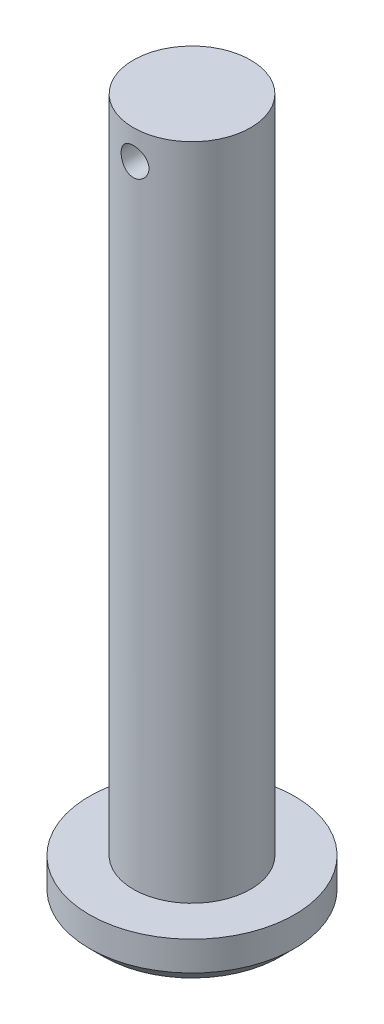
from build123d import *

# Parameters (mm, degrees)
SKETCH1_R           = 7
BOSS_EXTRUDE1_DEPTH = 3
SKETCH1_3_R         = 4
BOSS_EXTRUDE2_DEPTH = 45
CHAMFER1_SIZE       = 1
CUT_EXTRUDE1_REACH  = 48.851
SKETCH2_R           = 0.95


with BuildPart() as part:
    # Sketch1 → Boss-Extrude1 (new body)
    with BuildSketch(Plane(origin=(0, 0, 0), x_dir=(1, 0, 0), z_dir=(0, 1, 0))):
        Circle(SKETCH1_R)
    extrude(amount=-BOSS_EXTRUDE1_DEPTH)

    # Sketch1<3> → Boss-Extrude2 (add)
    with BuildSketch(Plane(origin=(0, 0, 0), x_dir=(1, 0, 0), z_dir=(0, 1, 0))):
        Circle(SKETCH1_3_R)
    extrude(amount=BOSS_EXTRUDE2_DEPTH)

    # Chamfer1
    chamfer1_edges = [part.edges().sort_by_distance(p)[0] for p in [
        (-7, -3, 0),
    ]]
    chamfer(chamfer1_edges, length=CHAMFER1_SIZE)

    # Sketch2 → Cut-Extrude1 (cut, up to next)
    with BuildSketch(Plane.XY.offset(4), mode=Mode.PRIVATE) as cut_extrude1_sk1:
        with Locations((0, 43)):
            Circle(SKETCH2_R)
    cut_extrude1_tool1 = extrude(cut_extrude1_sk1.sketch, amount=-CUT_EXTRUDE1_REACH, mode=Mode.PRIVATE) & part.part
    add(cut_extrude1_tool1.solids().sort_by_distance((0, 43, 4))[0], mode=Mode.SUBTRACT)


solid = part.part
